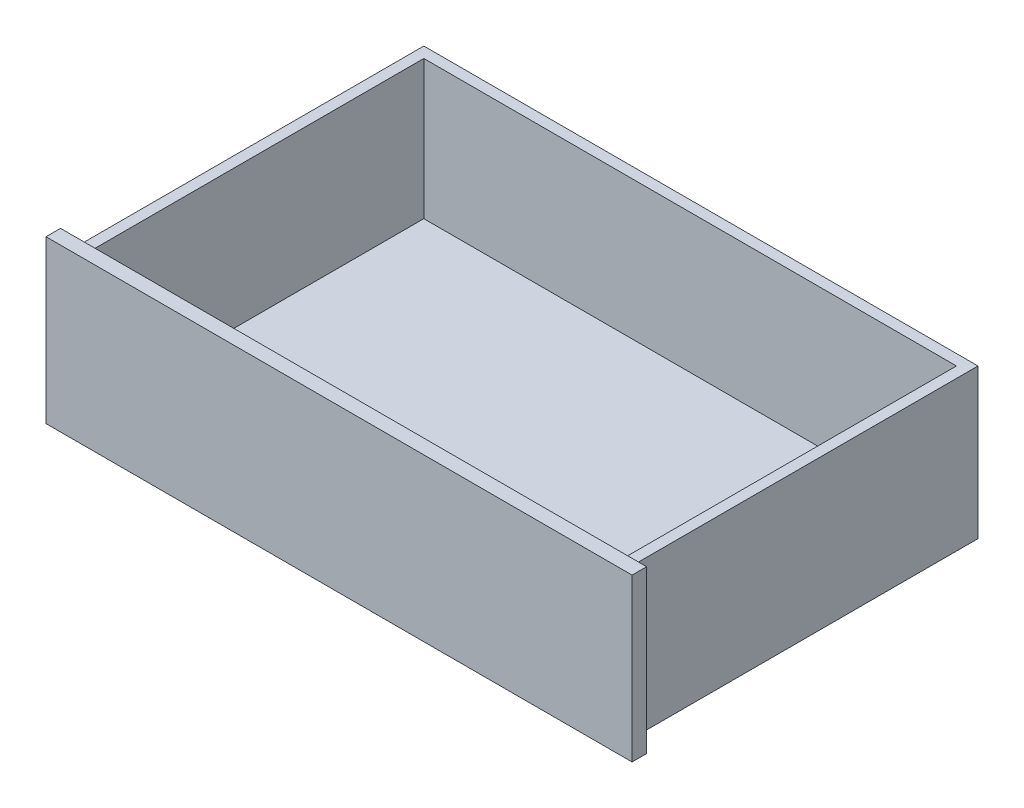
from build123d import *

# Parameters (mm, degrees)
SKETCH1_W           = 630
SKETCH1_H           = 400
EXTRUSION_DEPTH     = 170
DRAWER_S_INTERIOR_T = -12.2428
SKETCH3_W           = 666.2428
SKETCH3_H           = 184
BOSS_EXTRUDE3_DEPTH = 16.5


with BuildPart() as part:
    # Sketch1 → Extrusion (new body)
    with BuildSketch(Plane(origin=(0, 0, 0), x_dir=(1, 0, 0), z_dir=(0, 1, 0))):
        Rectangle(SKETCH1_W, SKETCH1_H)
    extrude(amount=EXTRUSION_DEPTH)

    # Drawer's interior
    drawer_s_interior_openings = [part.faces().sort_by_distance(p)[0] for p in [
        (0, 170, 0),
    ]]
    offset(amount=DRAWER_S_INTERIOR_T, openings=drawer_s_interior_openings, kind=Kind.INTERSECTION)

    # Sketch3 → Boss-Extrude3 (add)
    with BuildSketch(Plane.XY.offset(200)):
        with Locations((5.1214, 92)):
            Rectangle(SKETCH3_W, SKETCH3_H)
    extrude(amount=BOSS_EXTRUDE3_DEPTH)


solid = part.part
